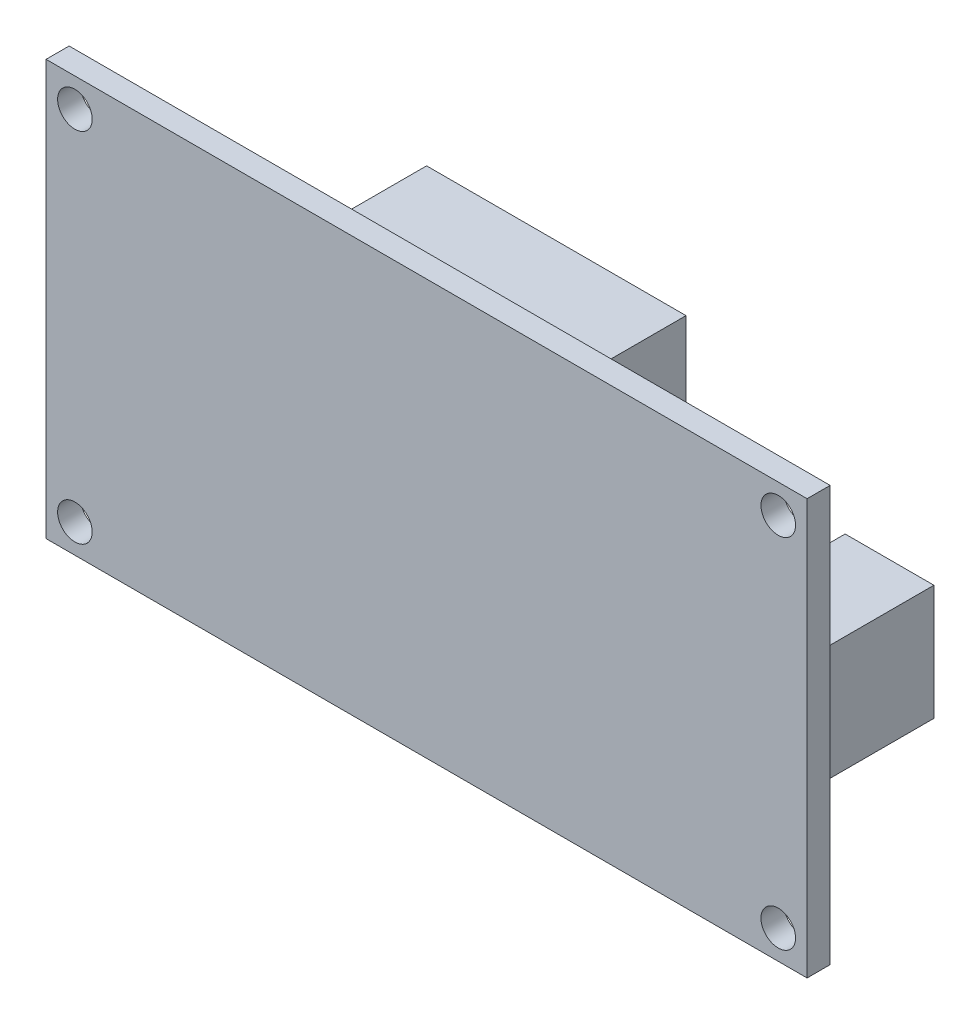
from build123d import *

# Parameters (mm, degrees)
SKETCH1_W           = 66
SKETCH1_H           = 36
SKETCH1_R           = 1.5
BOSS_EXTRUDE1_DEPTH = 2
SKETCH1_3_W         = 7.7
SKETCH1_3_H         = 10
BOSS_EXTRUDE2_DEPTH = 10
SKETCH1_4_W         = 22.5
SKETCH1_4_H         = 14
BOSS_EXTRUDE3_DEPTH = 7.5
SKETCH1_6_R         = 4
BOSS_EXTRUDE4_DEPTH = 10


with BuildPart() as part:
    # Sketch1 → Boss-Extrude1 (new body)
    with BuildSketch(Plane.XY):
        with Locations((33, 18)):
            Rectangle(SKETCH1_W, SKETCH1_H)
        with Locations((2.5, 2.5)):
            Circle(SKETCH1_R, mode=Mode.SUBTRACT)
        with Locations((63.5, 2.5)):
            Circle(SKETCH1_R, mode=Mode.SUBTRACT)
        with Locations((2.5, 33.5)):
            Circle(SKETCH1_R, mode=Mode.SUBTRACT)
        with Locations((63.5, 33.5)):
            Circle(SKETCH1_R, mode=Mode.SUBTRACT)
    extrude(amount=BOSS_EXTRUDE1_DEPTH)

    # Sketch1<3> → Boss-Extrude2 (add)
    with BuildSketch(Plane.XY):
        with Locations((61.15, 18)):
            Rectangle(SKETCH1_3_W, SKETCH1_3_H)
        with Locations((4.85, 18)):
            Rectangle(SKETCH1_3_W, SKETCH1_3_H)
    extrude(amount=-BOSS_EXTRUDE2_DEPTH)

    # Sketch1<4> → Boss-Extrude3 (add)
    with BuildSketch(Plane.XY):
        with Locations((34.75, 28)):
            Rectangle(SKETCH1_4_W, SKETCH1_4_H)
    extrude(amount=-BOSS_EXTRUDE3_DEPTH)

    # Sketch1<6> → Boss-Extrude4 (add)
    with BuildSketch(Plane.XY):
        with Locations((50, 10)):
            Circle(SKETCH1_6_R)
        with Locations((13, 10)):
            Circle(SKETCH1_6_R)
    extrude(amount=-BOSS_EXTRUDE4_DEPTH)


solid = part.part
